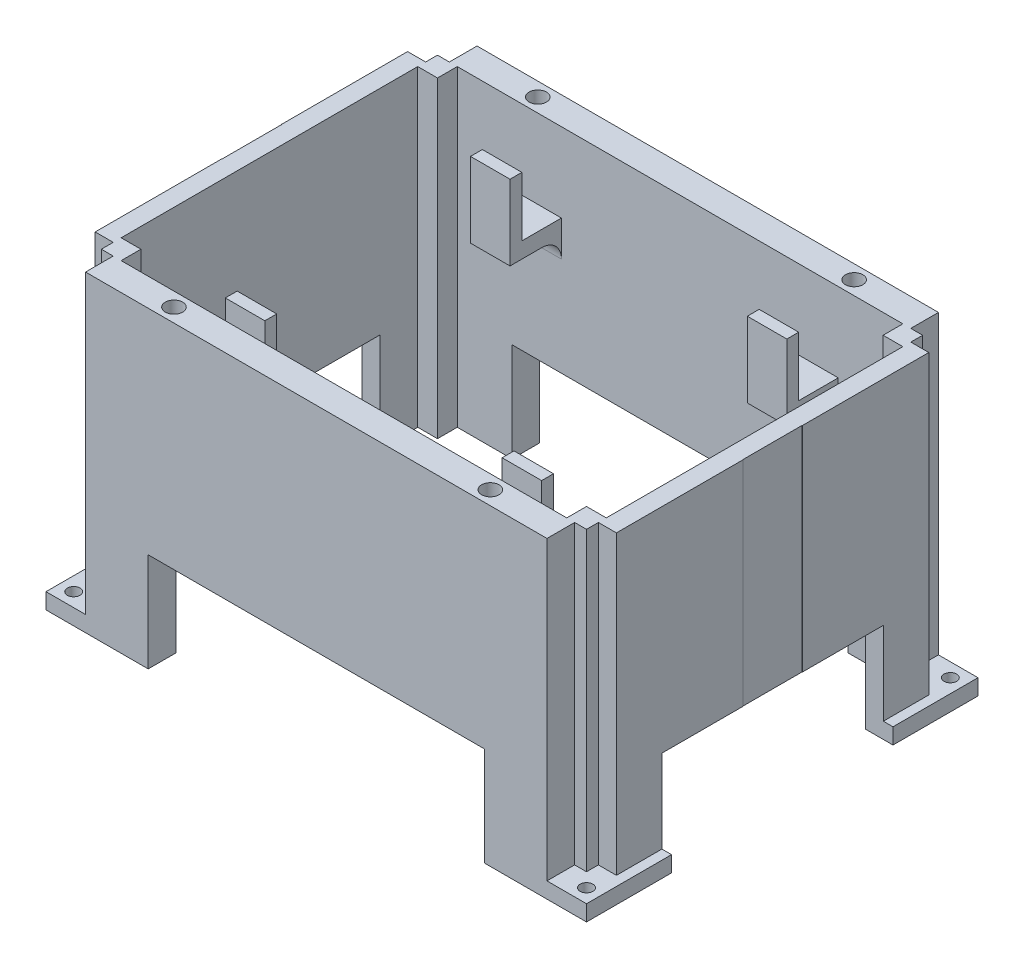
from build123d import *

# Parameters (mm, degrees)
SKETCH1_W               = 122.684034766
SKETCH1_H               = 85
BOSS_EXTRUDE1_DEPTH     = 4
CUT_EXTRUDE3_REACH      = 86.48
SKETCH3_R               = 1.6
SKETCH4_W               = 116.684034766
SKETCH4_H               = 7
BOSS_EXTRUDE2_DEPTH     = 75
SKETCH1_3_W             = 5
SKETCH1_3_H             = 5
BOSS_EXTRUDE3_DEPTH     = 79
SKETCH5_W               = 85
SKETCH5_H               = 25
CUT_EXTRUDE4_DEPTH      = 144.918835946
CUT_EXTRUDE5_DEPTH      = 166.450220187
CUT_EXTRUDE5_DEPTH_BACK = 166.450220187
SKETCH6_W               = 56
SKETCH6_H               = 25
SKETCH7_R               = 2.2
CUT_EXTRUDE6_DEPTH      = 10
BOSS_EXTRUDE4_DEPTH     = 13
SKETCH9_W               = 10
SKETCH9_H               = 3
BOSS_EXTRUDE5_DEPTH     = 15
FILLET1_R               = 5
MIRROR2_COPY_1_DEPTH    = 13
MIRROR2_COPY_2_SKETCH_W = 10
MIRROR2_COPY_2_SKETCH_H = 3
MIRROR2_COPY_2_DEPTH    = 15


with BuildPart() as part:
    # Sketch1 → Boss-Extrude1 (new body)
    with BuildSketch(Plane(origin=(0, 0, 0), x_dir=(1, 0, 0), z_dir=(0, 1, 0))):
        Polygon((-68.342017383, -49.5), (68.342017383, -49.5), (68.342017383, -7.5), (65.842017383, -7.5), (65.842017383, 7.5), (68.342017383, 7.5), (68.342017383, 49.5), (-68.342017383, 49.5), (-68.342017383, 7.5), (-65.842017383, 7.5), (-65.842017383, -7.5), (-68.342017383, -7.5), align=None)
        Rectangle(SKETCH1_W, SKETCH1_H, mode=Mode.SUBTRACT)
    extrude(amount=BOSS_EXTRUDE1_DEPTH)

    # Sketch3 → Cut-Extrude3 (cut, up to next)
    with BuildSketch(Plane(origin=(0, 0, 0), x_dir=(1, 0, 0), z_dir=(0, 1, 0)), mode=Mode.PRIVATE) as cut_extrude3_sk1:
        with Locations((64.842017383, -46)):
            Circle(SKETCH3_R)
    cut_extrude3_tool1 = extrude(cut_extrude3_sk1.sketch, amount=CUT_EXTRUDE3_REACH, mode=Mode.PRIVATE) & part.part
    # Sketch3 → Cut-Extrude3 (cut, up to next)
    with BuildSketch(Plane(origin=(0, 0, 0), x_dir=(1, 0, 0), z_dir=(0, 1, 0)), mode=Mode.PRIVATE) as cut_extrude3_sk2:
        with Locations((64.842017383, 46)):
            Circle(SKETCH3_R)
    cut_extrude3_tool2 = extrude(cut_extrude3_sk2.sketch, amount=CUT_EXTRUDE3_REACH, mode=Mode.PRIVATE) & part.part
    # Sketch3 → Cut-Extrude3 (cut, up to next)
    with BuildSketch(Plane(origin=(0, 0, 0), x_dir=(1, 0, 0), z_dir=(0, 1, 0)), mode=Mode.PRIVATE) as cut_extrude3_sk3:
        with Locations((-64.842017383, 46)):
            Circle(SKETCH3_R)
    cut_extrude3_tool3 = extrude(cut_extrude3_sk3.sketch, amount=CUT_EXTRUDE3_REACH, mode=Mode.PRIVATE) & part.part
    # Sketch3 → Cut-Extrude3 (cut, up to next)
    with BuildSketch(Plane(origin=(0, 0, 0), x_dir=(1, 0, 0), z_dir=(0, 1, 0)), mode=Mode.PRIVATE) as cut_extrude3_sk4:
        with Locations((-64.842017383, -46)):
            Circle(SKETCH3_R)
    cut_extrude3_tool4 = extrude(cut_extrude3_sk4.sketch, amount=CUT_EXTRUDE3_REACH, mode=Mode.PRIVATE) & part.part
    add(cut_extrude3_tool1.solids().sort_by_distance((64.842017, 0, 46))[0], mode=Mode.SUBTRACT)
    add(cut_extrude3_tool2.solids().sort_by_distance((64.842017, 0, -46))[0], mode=Mode.SUBTRACT)
    add(cut_extrude3_tool3.solids().sort_by_distance((-64.842017, 0, -46))[0], mode=Mode.SUBTRACT)
    add(cut_extrude3_tool4.solids().sort_by_distance((-64.842017, 0, 46))[0], mode=Mode.SUBTRACT)

    # Sketch4 → Boss-Extrude2 (add)
    with BuildSketch(Plane(origin=(0, 4, 0), x_dir=(1, 0, 0), z_dir=(0, 1, 0))):
        with Locations((0, 46)):
            Rectangle(SKETCH4_W, SKETCH4_H)
        Polygon((-61.342017383, -39.5), (-61.342017383, 39.5), (-65.904231228, 39.5), (-65.904231228, 7.5), (-65.842017383, 7.5), (-65.842017383, -7.5), (-65.904231228, -7.5), (-65.904231228, -39.5), align=None)
        Polygon((65.904231228, 39.5), (61.342017383, 39.5), (61.342017383, -39.5), (65.904231228, -39.5), (65.904231228, -7.5), (65.842017383, -7.5), (65.842017383, 7.5), (65.904231228, 7.5), align=None)
        with Locations((0, -46)):
            Rectangle(SKETCH4_W, SKETCH4_H)
    extrude(amount=BOSS_EXTRUDE2_DEPTH)

    # Sketch1<3> → Boss-Extrude3 (add)
    with BuildSketch(Plane(origin=(0, 0, 0), x_dir=(1, 0, 0), z_dir=(0, 1, 0))):
        with Locations((-58.842017383, -40)):
            Rectangle(SKETCH1_3_W, SKETCH1_3_H)
        with Locations((58.842017383, -40)):
            Rectangle(SKETCH1_3_W, SKETCH1_3_H)
        with Locations((-58.842017383, 40)):
            Rectangle(SKETCH1_3_W, SKETCH1_3_H)
        with Locations((58.842017383, 40)):
            Rectangle(SKETCH1_3_W, SKETCH1_3_H)
    extrude(amount=BOSS_EXTRUDE3_DEPTH)

    # Sketch5 → Cut-Extrude4 (cut, through all)
    with BuildSketch(Plane.XY.offset(49.5)):
        with Locations((0, 12.5)):
            Rectangle(SKETCH5_W, SKETCH5_H)
    extrude(amount=-CUT_EXTRUDE4_DEPTH, mode=Mode.SUBTRACT)

    # Sketch6 → Cut-Extrude5 (cut, two sides: drawn at the far end of the back side and taken through both)
    with BuildSketch(Plane(origin=(68.342017383, 0, 0), x_dir=(0, 0, -1), z_dir=(1, 0, 0)).offset(-CUT_EXTRUDE5_DEPTH_BACK)):
        with Locations((0, 12.5)):
            Rectangle(SKETCH6_W, SKETCH6_H)
    extrude(amount=CUT_EXTRUDE5_DEPTH + CUT_EXTRUDE5_DEPTH_BACK, mode=Mode.SUBTRACT)

    # Sketch7 → Cut-Extrude6 (cut)
    with BuildSketch(Plane(origin=(0, 79, 0), x_dir=(1, 0, 0), z_dir=(0, 1, 0))):
        with Locations((40.521857066, 46)):
            Circle(SKETCH7_R)
        with Locations((-39.478142934, 46)):
            Circle(SKETCH7_R)
        with Locations((-39.478142934, -46)):
            Circle(SKETCH7_R)
        with Locations((40.521857066, -46)):
            Circle(SKETCH7_R)
    extrude(amount=-CUT_EXTRUDE6_DEPTH, mode=Mode.SUBTRACT)

    # Sketch8 → Boss-Extrude4 (add)
    with BuildSketch(Plane.XY.offset(-42.5)):
        Polygon((-35, 59), (-40, 59), (-40, 55), (-30, 55), (-30, 59), align=None)
    boss_extrude4 = extrude(amount=BOSS_EXTRUDE4_DEPTH)

    # Sketch9 → Boss-Extrude5 (add)
    with BuildSketch(Plane(origin=(0, 59, 0), x_dir=(1, 0, 0), z_dir=(0, 1, 0))):
        with Locations((-35, 31)):
            Rectangle(SKETCH9_W, SKETCH9_H)
    boss_extrude5 = extrude(amount=BOSS_EXTRUDE5_DEPTH)

    # Fillet1
    fillet1_edges = [part.edges().sort_by_distance(p)[0] for p in [
        (-35, 55, -42.5),
    ]]
    fillet(fillet1_edges, radius=FILLET1_R)

    # Mirror1: Boss-Extrude4, Boss-Extrude5 across plane
    add(boss_extrude4.mirror(Plane.XY))
    add(boss_extrude5.mirror(Plane.XY))

    # Mirror2: Boss-Extrude4, Boss-Extrude5 across plane
    add(boss_extrude4.mirror(Plane(origin=(0, 0, 0), x_dir=(0, 0, 1), z_dir=(1, 0, 0))))
    add(boss_extrude5.mirror(Plane(origin=(0, 0, 0), x_dir=(0, 0, 1), z_dir=(1, 0, 0))))

    # Mirror2 copy 1 sketch → Mirror2 copy 1 (add)
    with BuildSketch(Plane(origin=(0, 0, 42.5), x_dir=(-1, 0, 0), z_dir=(0, 0, -1))):
        Polygon((-35, 59), (-40, 59), (-40, 55), (-30, 55), (-30, 59), align=None)
    extrude(amount=MIRROR2_COPY_1_DEPTH)

    # Mirror2 copy 2 sketch → Mirror2 copy 2 (add)
    with BuildSketch(Plane(origin=(0, 59, 0), x_dir=(-1, 0, 0), z_dir=(0, 1, 0))):
        with Locations((-35, 31)):
            Rectangle(MIRROR2_COPY_2_SKETCH_W, MIRROR2_COPY_2_SKETCH_H)
    extrude(amount=MIRROR2_COPY_2_DEPTH)


solid = part.part
